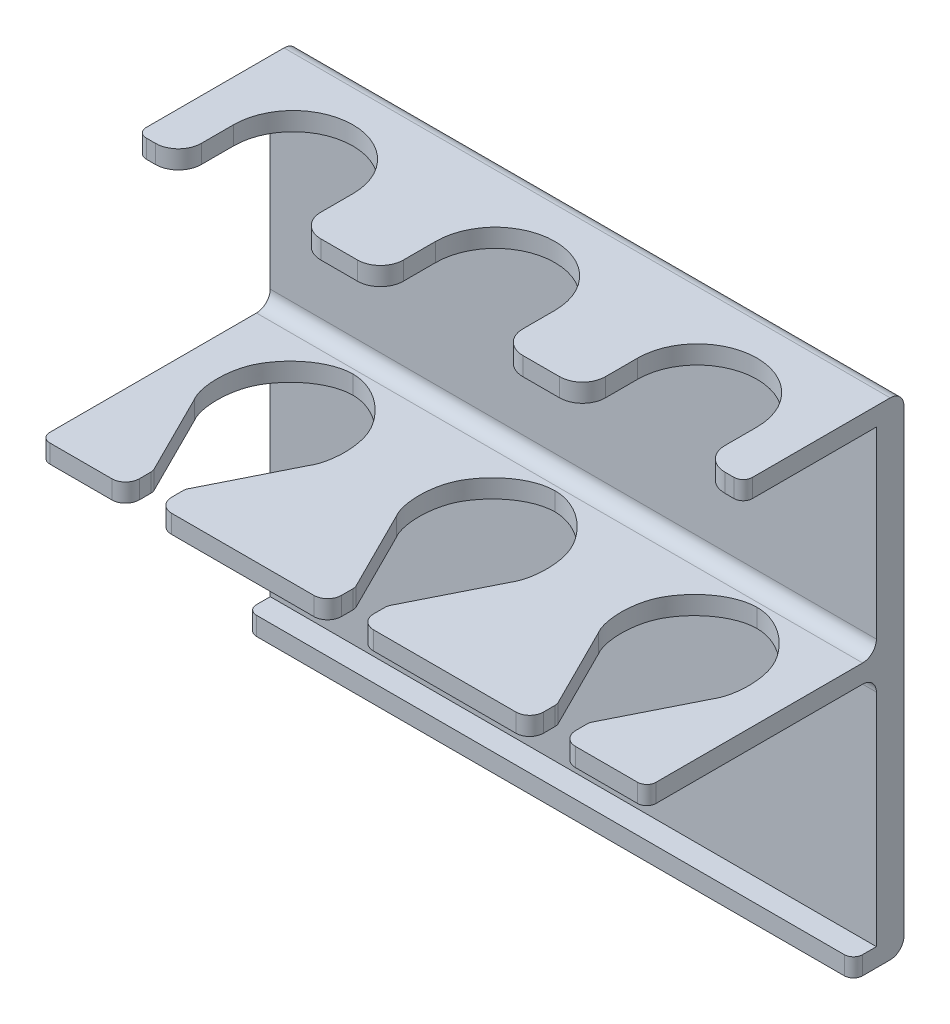
from build123d import *

# Parameters (mm, degrees)
SKETCH1_W           = 238
SKETCH1_H           = 43
SKETCH1_H_2         = 4
SKETCH1_H_3         = 51
BOSS_EXTRUDE1_DEPTH = 6
SKETCH2_W           = 238
SKETCH2_H           = 4
BOSS_EXTRUDE2_DEPTH = 35
SKETCH3_W           = 26
SKETCH3_H           = 12
CUT_EXTRUDE1_DEPTH  = 6
FILLET1_R           = 5
SKETCH4_W           = 238
SKETCH4_H           = 64
BOSS_EXTRUDE3_DEPTH = 4
SKETCH6_W           = 238
SKETCH6_H           = 11
BOSS_EXTRUDE4_DEPTH = 4
CUT_EXTRUDE2_DEPTH  = 10
SKETCH8_W           = 238
SKETCH8_H           = 8
CUT_EXTRUDE3_DEPTH  = 60
FILLET2_R           = 3
FILLET3_R           = 2
FILLET4_R           = 3
CUT_EXTRUDE4_DEPTH  = 150
FILLET5_R           = 2


with BuildPart() as part:
    # Sketch1 → Boss-Extrude1 (new body)
    with BuildSketch(Plane.XY):
        with Locations((0, 54.430088496)):
            Rectangle(SKETCH1_W, SKETCH1_H)
        Polygon((-119, 79.930088496), (-119, 75.930088496), (119, 75.930088496), (119, 79.930088496), (101, 79.930088496), (75, 79.930088496), (57.077876106, 79.930088496), (57, 79.930088496), (31, 79.930088496), (13, 79.930088496), (-13, 79.930088496), (-31, 79.930088496), (-57, 79.930088496), (-75, 79.930088496), (-101, 79.930088496), align=None)
        with Locations((0, 30.930088496)):
            Rectangle(SKETCH1_W, SKETCH1_H_2)
        with Locations((0, 3.430088496)):
            Rectangle(SKETCH1_W, SKETCH1_H_3)
        with Locations((0, -24.069911504)):
            Rectangle(SKETCH1_W, SKETCH1_H_2)
    extrude(amount=BOSS_EXTRUDE1_DEPTH)

    # Sketch2 → Boss-Extrude2 (add)
    with BuildSketch(Plane.XY):
        with Locations((0, 77.930088496)):
            Rectangle(SKETCH2_W, SKETCH2_H)
    extrude(amount=BOSS_EXTRUDE2_DEPTH)

    # Sketch3 → Cut-Extrude1 (cut)
    with BuildSketch(Plane(origin=(0, 79.930088496, 0), x_dir=(1, 0, 0), z_dir=(0, 1, 0))):
        with BuildLine():
            ThreePointArc((-101, -23), (-88, -10), (-75, -23))
            Line((-75, -23), (-101, -23))
        make_face()
        with Locations((-88, -29)):
            Rectangle(SKETCH3_W, SKETCH3_H)
        with BuildLine():
            ThreePointArc((-57, -23), (-44, -10), (-31, -23))
            Line((-31, -23), (-31, -35))
            Line((-31, -35), (-57, -35))
            Line((-57, -35), (-57, -23))
        make_face()
        with BuildLine():
            Line((13, -35), (13, -23))
            ThreePointArc((13, -23), (0, -10), (-13, -23))
            Line((-13, -23), (-13, -35))
            Line((-13, -35), (13, -35))
        make_face()
        with BuildLine():
            Line((57, -35), (57, -23))
            ThreePointArc((57, -23), (44, -10), (31, -23))
            Line((31, -23), (31, -35))
            Line((31, -35), (57, -35))
        make_face()
        with BuildLine():
            Line((101, -35), (101, -23))
            ThreePointArc((101, -23), (88, -10), (75, -23))
            Line((75, -23), (75, -35))
            Line((75, -35), (101, -35))
        make_face()
    extrude(amount=-CUT_EXTRUDE1_DEPTH, mode=Mode.SUBTRACT)

    # Fillet1
    fillet1_edges = [part.edges().sort_by_distance(p)[0] for p in [
        (-119, 77.930088496, 35),
        (119, 77.930088496, 35),
        (75, 77.930088496, 35),
        (101, 77.930088496, 35),
        (31, 77.930088496, 35),
        (57, 77.930088496, 35),
        (-13, 77.930088496, 35),
        (13, 77.930088496, 35),
        (-57, 77.930088496, 35),
        (-31, 77.930088496, 35),
        (-101, 77.930088496, 35),
        (-75, 77.930088496, 35),
    ]]
    fillet(fillet1_edges, radius=FILLET1_R)

    # Sketch4 → Boss-Extrude3 (add)
    with BuildSketch(Plane(origin=(0, 32.930088496, 0), x_dir=(1, 0, 0), z_dir=(0, 1, 0))):
        with Locations((0, -32)):
            Rectangle(SKETCH4_W, SKETCH4_H)
    extrude(amount=-BOSS_EXTRUDE3_DEPTH)

    # Sketch6 → Boss-Extrude4 (add)
    with BuildSketch(Plane(origin=(0, -22.069911504, 0), x_dir=(1, 0, 0), z_dir=(0, 1, 0))):
        with Locations((0, -5.5)):
            Rectangle(SKETCH6_W, SKETCH6_H)
    extrude(amount=-BOSS_EXTRUDE4_DEPTH)

    # Sketch5 → Cut-Extrude2 (cut)
    with BuildSketch(Plane(origin=(0, 32.930088496, 0), x_dir=(1, 0, 0), z_dir=(0, 1, 0))):
        with BuildLine():
            Line((-40.5, -50), (-40.5, -56))
            Line((-40.5, -56), (-47.5, -56))
            Line((-47.5, -56), (-47.5, -50))
            Line((-47.5, -50), (-56.5, -32))
            add(Edge.make_bspline(
                [(-56.5, -32), (-58.118524022, -29.356350797), (-58.608084098, -22.1569248), (-53.268932872, -13.423946955), (-48.161141466, -10.022473266), (-44, -10)],
                knots=[0, 0, 0, 0, 0.224491173, 0.274489259, 0.499980858, 0.499980858, 0.499980858, 0.499980858], degree=3))
            add(Edge.make_bspline(
                [(-31.5, -32), (-29.881475978, -29.356350797), (-29.391915902, -22.1569248), (-34.731067128, -13.423946955), (-39.838858534, -10.022473266), (-44, -10)],
                knots=[0, 0, 0, 0, 0.224491173, 0.274489259, 0.499980858, 0.499980858, 0.499980858, 0.499980858], degree=3))
            Line((-31.5, -32), (-40.5, -50))
        make_face()
        with BuildLine():
            Line((-84.5, -50), (-75.5, -32))
            add(Edge.make_bspline(
                [(-75.5, -32), (-73.881475978, -29.356350797), (-73.391915902, -22.1569248), (-78.731067128, -13.423946955), (-83.838858534, -10.022473266), (-88, -10)],
                knots=[0, 0, 0, 0, 0.224491173, 0.274489259, 0.499980858, 0.499980858, 0.499980858, 0.499980858], degree=3))
            add(Edge.make_bspline(
                [(-100.5, -32), (-102.118524022, -29.356350797), (-102.608084098, -22.1569248), (-97.268932872, -13.423946955), (-92.161141466, -10.022473266), (-88, -10)],
                knots=[0, 0, 0, 0, 0.224491173, 0.274489259, 0.499980858, 0.499980858, 0.499980858, 0.499980858], degree=3))
            Line((-100.5, -32), (-91.5, -50))
            Line((-91.5, -50), (-91.5, -56))
            Line((-91.5, -56), (-84.5, -56))
            Line((-84.5, -56), (-84.5, -50))
        make_face()
        with BuildLine():
            Line((3.5, -50), (12.5, -32))
            add(Edge.make_bspline(
                [(12.5, -32), (14.118524022, -29.356350797), (14.608084098, -22.1569248), (9.268932872, -13.423946955), (4.161141466, -10.022473266), (0, -10)],
                knots=[0, 0, 0, 0, 0.224491173, 0.274489259, 0.499980858, 0.499980858, 0.499980858, 0.499980858], degree=3))
            add(Edge.make_bspline(
                [(-12.5, -32), (-14.118524022, -29.356350797), (-14.608084098, -22.1569248), (-9.268932872, -13.423946955), (-4.161141466, -10.022473266), (0, -10)],
                knots=[0, 0, 0, 0, 0.224491173, 0.274489259, 0.499980858, 0.499980858, 0.499980858, 0.499980858], degree=3))
            Line((-12.5, -32), (-3.5, -50))
            Line((-3.5, -50), (-3.5, -56))
            Line((-3.5, -56), (3.5, -56))
            Line((3.5, -56), (3.5, -50))
        make_face()
    extrude(amount=-CUT_EXTRUDE2_DEPTH, mode=Mode.SUBTRACT)

    # Sketch8 → Cut-Extrude3 (cut)
    with BuildSketch(Plane(origin=(0, 0, 0), x_dir=(1, 0, 0), z_dir=(0, 1, 0))):
        with Locations((0, -60)):
            Rectangle(SKETCH8_W, SKETCH8_H)
    extrude(amount=CUT_EXTRUDE3_DEPTH, mode=Mode.SUBTRACT)

    # Fillet2
    fillet2_edges = [part.edges().sort_by_distance(p)[0] for p in [
        (-84.5, 30.930088496, 56),
        (-91.5, 30.930088496, 56),
        (3.5, 30.930088496, 56),
        (-3.5, 30.930088496, 56),
        (-40.5, 30.930088496, 56),
        (-47.5, 30.930088496, 56),
    ]]
    fillet(fillet2_edges, radius=FILLET2_R)

    # Fillet3
    fillet3_edges = [part.edges().sort_by_distance(p)[0] for p in [
        (-84.5, 30.930088496, 50),
        (-91.5, 30.930088496, 50),
        (3.5, 30.930088496, 50),
        (-3.5, 30.930088496, 50),
        (-40.5, 30.930088496, 50),
        (-47.5, 30.930088496, 50),
    ]]
    fillet(fillet3_edges, radius=FILLET3_R)

    # Fillet4
    fillet4_edges = [part.edges().sort_by_distance(p)[0] for p in [
        (0, 28.930088496, 6),
        (0, 32.930088496, 6),
        (0, -26.069911504, 0),
        (0, 79.930088496, 0),
    ]]
    fillet(fillet4_edges, radius=FILLET4_R)

    # Sketch9 → Cut-Extrude4 (cut, symmetric)
    with BuildSketch(Plane(origin=(0, 0, 0), x_dir=(1, 0, 0), z_dir=(0, 1, 0))):
        Polygon((-110, -70.570691383), (-110, -35), (-110, 17.336036992), (-146.355677451, 17.336036992), (-144.312296295, -70.570691383), align=None)
        Polygon((136.221626858, 30.554600482), (22, 30.554600482), (22, -35), (22, -79.242199879), (136.221626858, -79.242199879), align=None)
    extrude(amount=CUT_EXTRUDE4_DEPTH, both=True, mode=Mode.SUBTRACT)

    # Fillet5
    fillet5_edges = [part.edges().sort_by_distance(p)[0] for p in [
        (-110, 77.930088496, 35),
        (-110, 30.930088496, 56),
        (-110, -24.069911504, 11),
        (22, 30.930088496, 56),
        (22, -24.069911504, 11),
        (22, 77.930088496, 35),
    ]]
    fillet(fillet5_edges, radius=FILLET5_R)


solid = part.part
